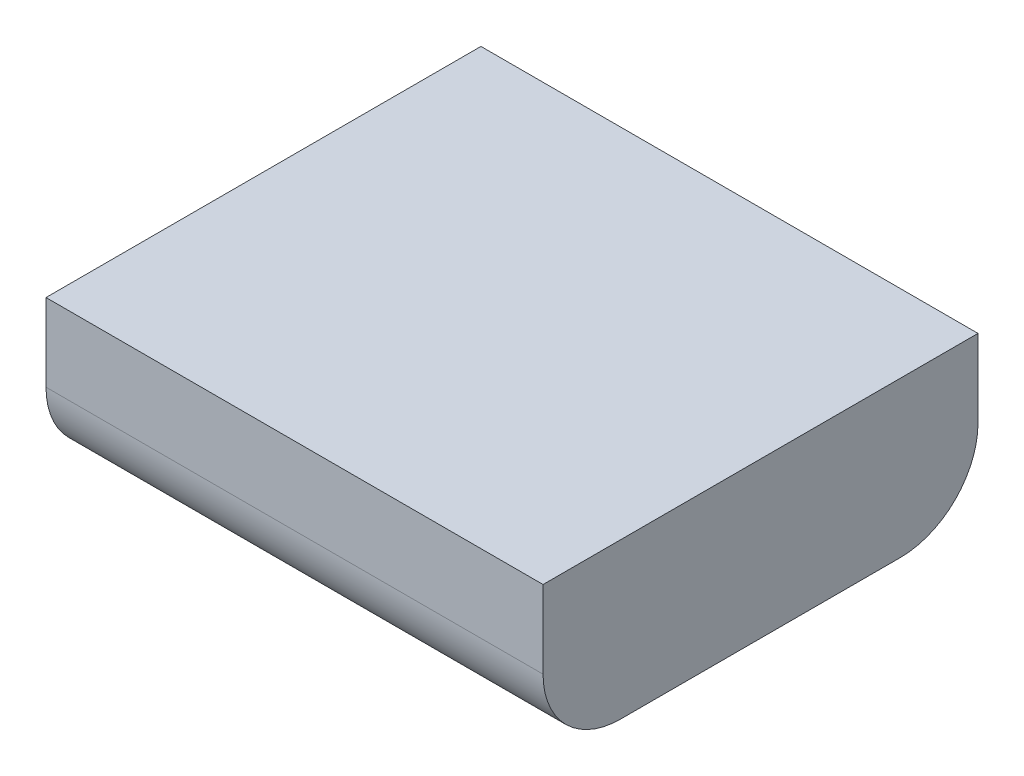
from build123d import *

# Parameters (mm, degrees)
SKETCH1_W           = 28
SKETCH1_H           = 10
BOSS_EXTRUDE1_DEPTH = 16
FILLET1_R           = 5


with BuildPart() as part:
    # Sketch1 → Boss-Extrude1 (new, symmetric)
    with BuildSketch(Plane(origin=(0, 0, 0), x_dir=(0, 0, -1), z_dir=(1, 0, 0))):
        Rectangle(SKETCH1_W, SKETCH1_H)
    extrude(amount=BOSS_EXTRUDE1_DEPTH, both=True)

    # Fillet1
    fillet1_edges = [part.edges().sort_by_distance(p)[0] for p in [
        (0, -5, -14),
        (0, -5, 14),
    ]]
    fillet(fillet1_edges, radius=FILLET1_R)


solid = part.part
